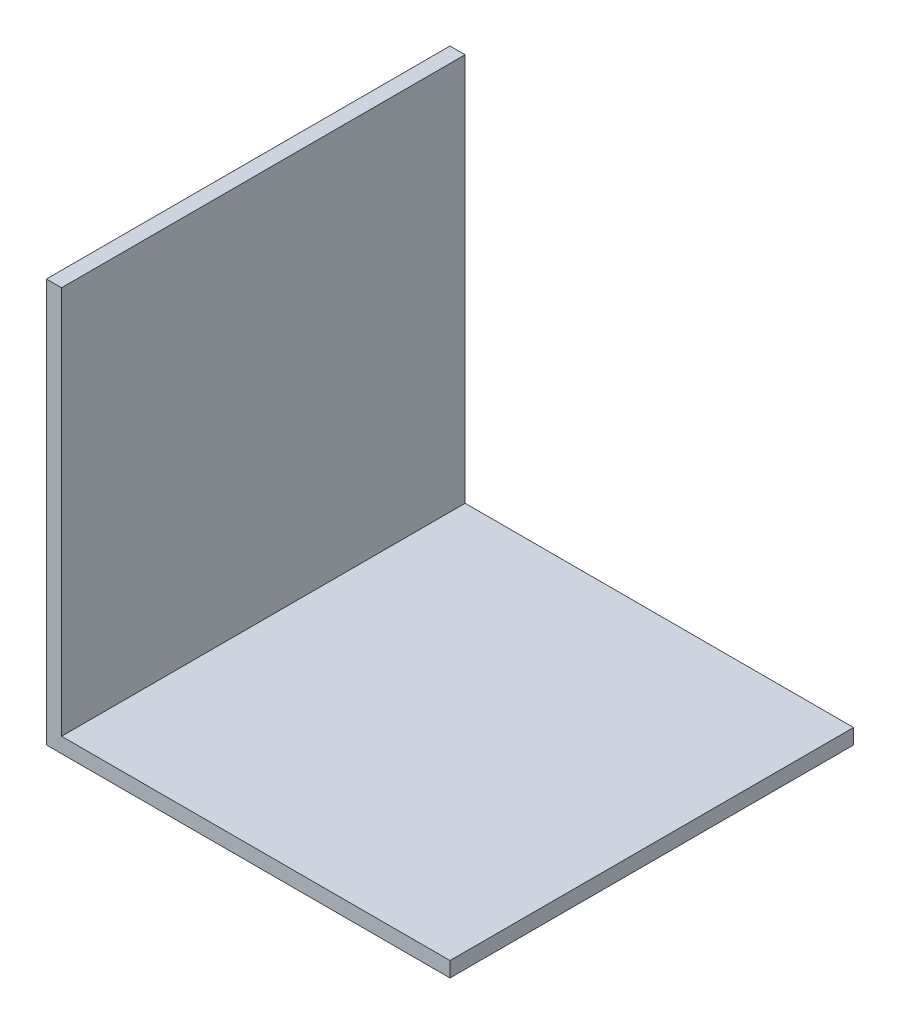
from build123d import *

# Parameters (mm, degrees)
EXTRUDE_1_DEPTH = 40


with BuildPart() as part:
    # Эскиз1 → Бобышка-Вытянуть1 (new body)
    with BuildSketch(Plane.XY):
        Polygon((0, 0), (40, 0), (40, 1.5), (1.5, 1.5), (1.5, 40), (0, 40), align=None)
    extrude(amount=EXTRUDE_1_DEPTH)


solid = part.part
